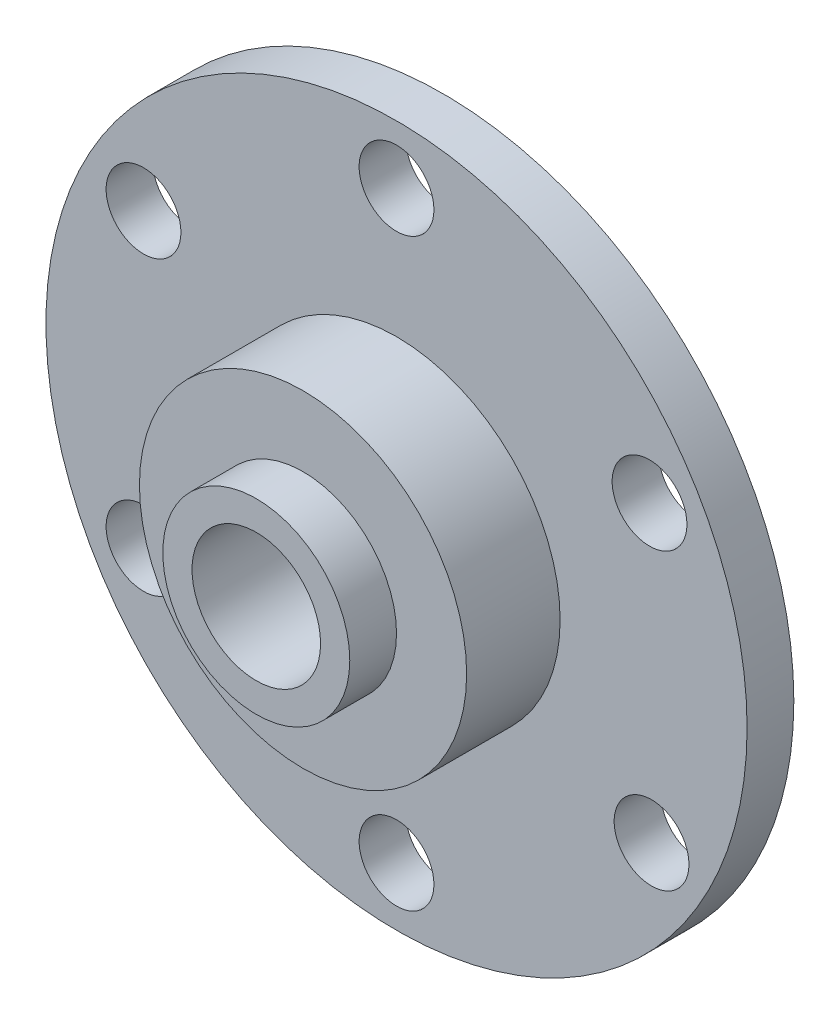
from build123d import *

# Parameters (mm, degrees)
ESQUISSE1_R        = 15
ESQUISSE1_R_2      = 1.6
ESQUISSE1_R_3      = 2.75
BOSS_EXTRU_1_DEPTH = 2
ESQUISSE2_R        = 7
ESQUISSE2_R_2      = 2.75
BOSS_EXTRU_2_DEPTH = 4
ESQUISSE3_R        = 4
ESQUISSE3_R_2      = 2.75
BOSS_EXTRU_3_DEPTH = 2


with BuildPart() as part:
    # Esquisse1 → Boss.-Extru.1 (new body)
    with BuildSketch(Plane.XY):
        Circle(ESQUISSE1_R)
        with Locations((0, 12.5)):
            Circle(ESQUISSE1_R_2, mode=Mode.SUBTRACT)
        with Locations((-10.825317547, 6.25)):
            Circle(ESQUISSE1_R_2, mode=Mode.SUBTRACT)
        with Locations((-10.825317547, -6.25)):
            Circle(ESQUISSE1_R_2, mode=Mode.SUBTRACT)
        with Locations((0, -12.5)):
            Circle(ESQUISSE1_R_2, mode=Mode.SUBTRACT)
        with Locations((10.911920088, -6.3)):
            Circle(ESQUISSE1_R_2, mode=Mode.SUBTRACT)
        with Locations((10.825317547, 6.25)):
            Circle(ESQUISSE1_R_2, mode=Mode.SUBTRACT)
        Circle(ESQUISSE1_R_3, mode=Mode.SUBTRACT)
    extrude(amount=BOSS_EXTRU_1_DEPTH)

    # Esquisse2 → Boss.-Extru.2 (add)
    with BuildSketch(Plane.XY.offset(2)):
        Circle(ESQUISSE2_R)
        Circle(ESQUISSE2_R_2, mode=Mode.SUBTRACT)
    extrude(amount=BOSS_EXTRU_2_DEPTH)

    # Esquisse3 → Boss.-Extru.3 (add)
    with BuildSketch(Plane.XY.offset(6)):
        Circle(ESQUISSE3_R)
        Circle(ESQUISSE3_R_2, mode=Mode.SUBTRACT)
    extrude(amount=BOSS_EXTRU_3_DEPTH)


solid = part.part
